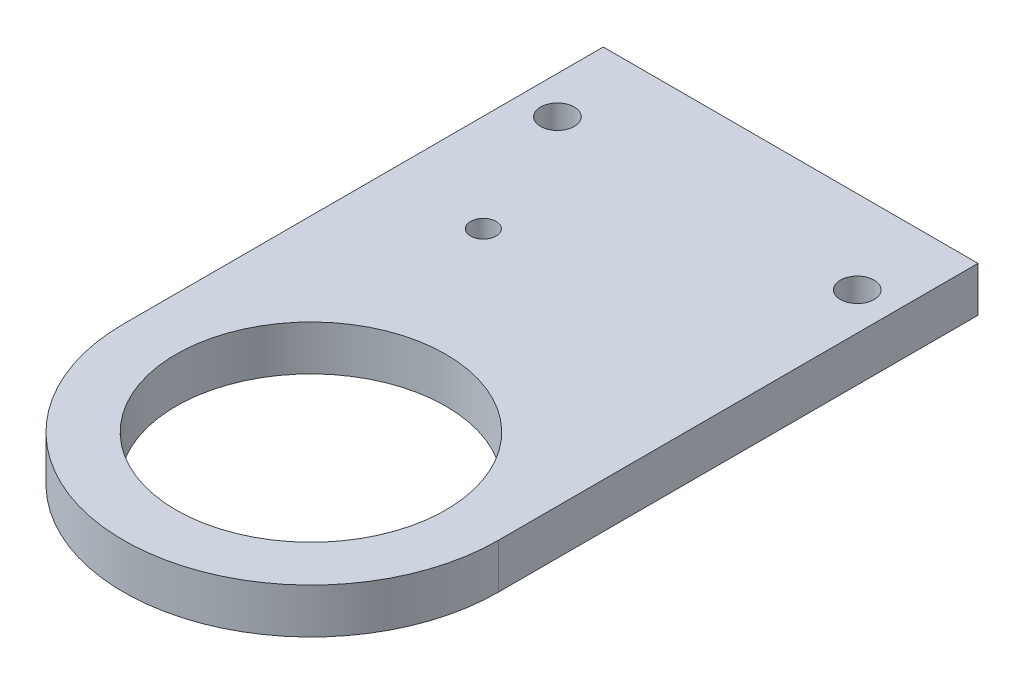
from build123d import *

# Parameters (mm, degrees)
PARED_START               = 21.5
SK_PARED_W                = 50
SK_PARED_H                = 64
PARED_DEPTH               = 6
CABEZA_START              = 21.5
SK_CABEZA_R               = 25
CABEZA_DEPTH              = 6
PASO_CUBO_J5_START        = 21.5
SK_PASO_CUBO_J5_R         = 18
PASO_CUBO_J5_DEPTH        = 6
PASANTES_M4_ANGULOS_START = 21.5
SK_PASANTES_M4_ANGULOS_R  = 2.25
PASANTES_M4_ANGULOS_DEPTH = 6
PASANTE_M3_CINCHO_START   = 21.5
SK_PASANTE_M3_CINCHO_R    = 1.7
PASANTE_M3_CINCHO_DEPTH   = 6


with BuildPart() as part:
    # Sk_Pared → Pared (new body)
    with BuildSketch(Plane(origin=(0, 0, 0), x_dir=(1, 0, 0), z_dir=(0, 1, 0)).offset(PARED_START)):
        with Locations((0, -458)):
            Rectangle(SK_PARED_W, SK_PARED_H)
    extrude(amount=PARED_DEPTH)

    # Sk_Cabeza → Cabeza (add)
    with BuildSketch(Plane(origin=(0, 0, 0), x_dir=(1, 0, 0), z_dir=(0, 1, 0)).offset(CABEZA_START)):
        with Locations((0, -490)):
            Circle(SK_CABEZA_R)
    extrude(amount=CABEZA_DEPTH)

    # Sk_Paso_cubo_J5 → Paso_cubo_J5 (cut)
    with BuildSketch(Plane(origin=(0, 0, 0), x_dir=(1, 0, 0), z_dir=(0, 1, 0)).offset(PASO_CUBO_J5_START)):
        with Locations(Location((0, -490, 0), (0, 0, 270))):
            Circle(SK_PASO_CUBO_J5_R)
    extrude(amount=PASO_CUBO_J5_DEPTH, mode=Mode.SUBTRACT)

    # Sk_Pasantes_M4_angulos → Pasantes_M4_angulos (cut)
    with BuildSketch(Plane(origin=(0, 0, 0), x_dir=(1, 0, 0), z_dir=(0, 1, 0)).offset(PASANTES_M4_ANGULOS_START)):
        with Locations(Location((-20, -437.11, 0), (0, 0, 270))):
            Circle(SK_PASANTES_M4_ANGULOS_R)
        with Locations(Location((20, -437.11, 0), (0, 0, 270))):
            Circle(SK_PASANTES_M4_ANGULOS_R)
    extrude(amount=PASANTES_M4_ANGULOS_DEPTH, mode=Mode.SUBTRACT)

    # Sk_Pasante_M3_cincho → Pasante_M3_cincho (cut)
    with BuildSketch(Plane(origin=(0, 0, 0), x_dir=(1, 0, 0), z_dir=(0, 1, 0)).offset(PASANTE_M3_CINCHO_START)):
        with Locations(Location((-12, -455, 0), (0, 0, 270))):
            Circle(SK_PASANTE_M3_CINCHO_R)
    extrude(amount=PASANTE_M3_CINCHO_DEPTH, mode=Mode.SUBTRACT)


solid = part.part
